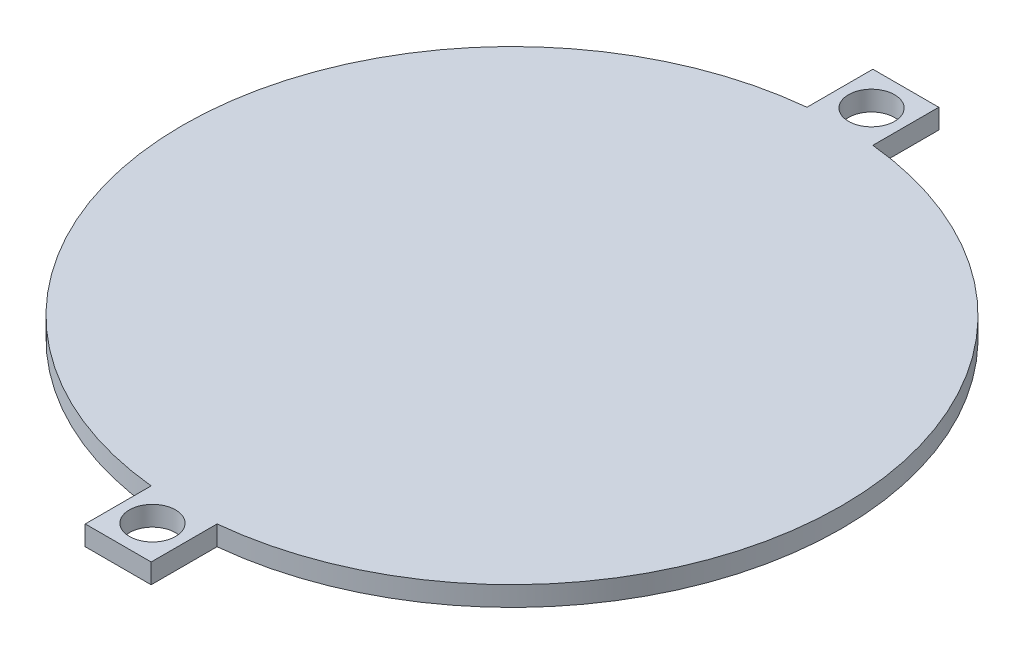
from build123d import *

# Parameters (mm, degrees)
SKETCH2_R               = 50
BOSS_EXTRUDE1_DEPTH     = 12
SKETCH3_R               = 48
CUT_EXTRUDE1_DEPTH      = 10
SKETCH7_W               = 10
SKETCH7_H               = 10
BOSS_EXTRUDE12_DEPTH    = 3
SKETCH8_W               = 10
SKETCH8_H               = 10
BOSS_EXTRUDE13_DEPTH    = 3
SKETCH9_R               = 3.5
CUT_EXTRUDE2_DEPTH      = 10
SKETCH10_R              = 3.5
CUT_EXTRUDE3_DEPTH      = 10
CUT_EXTRUDE4_DEPTH      = 100
CUT_EXTRUDE4_DEPTH_BACK = 100
SKETCH11_W              = 125.880590586
SKETCH11_H              = 15.914036276
BOSS_EXTRUDE15_START    = -3
SKETCH12_R              = 48
BOSS_EXTRUDE15_DEPTH    = 3


with BuildPart() as part:
    # Sketch2 → Boss-Extrude1 (new body)
    with BuildSketch(Plane(origin=(0, 0, 0), x_dir=(1, 0, 0), z_dir=(0, 1, 0))):
        Circle(SKETCH2_R)
    extrude(amount=BOSS_EXTRUDE1_DEPTH)

    # Sketch3 → Cut-Extrude1 (cut)
    with BuildSketch(Plane.XZ):
        Circle(SKETCH3_R)
    extrude(amount=-CUT_EXTRUDE1_DEPTH, mode=Mode.SUBTRACT)

    # Sketch7 → Boss-Extrude12 (add)
    with BuildSketch(Plane(origin=(0, 0, 0), x_dir=(-1, 0, 0), z_dir=(0, -1, 0))):
        with Locations((0, 54.749371855)):
            Rectangle(SKETCH7_W, SKETCH7_H)
    extrude(amount=-BOSS_EXTRUDE12_DEPTH)

    # Sketch8 → Boss-Extrude13 (add)
    with BuildSketch(Plane(origin=(0, 0, 0), x_dir=(-1, 0, 0), z_dir=(0, -1, 0))):
        with Locations((0, -54.749371855)):
            Rectangle(SKETCH8_W, SKETCH8_H)
    extrude(amount=-BOSS_EXTRUDE13_DEPTH)

    # Sketch9 → Cut-Extrude2 (cut)
    with BuildSketch(Plane.XZ):
        with Locations((0, 54.549371855)):
            Circle(SKETCH9_R)
    extrude(amount=-CUT_EXTRUDE2_DEPTH, mode=Mode.SUBTRACT)

    # Sketch10 → Cut-Extrude3 (cut)
    with BuildSketch(Plane.XZ):
        with Locations((0, -54.549371855)):
            Circle(SKETCH10_R)
    extrude(amount=-CUT_EXTRUDE3_DEPTH, mode=Mode.SUBTRACT)

    # Sketch11 → Cut-Extrude4 (cut, two sides: drawn at the far end of the back side and taken through both)
    with BuildSketch(Plane(origin=(5, 0, 0), x_dir=(0, 0, -1), z_dir=(1, 0, 0)).offset(-CUT_EXTRUDE4_DEPTH_BACK)):
        with Locations((3.190923438, 10.957018138)):
            Rectangle(SKETCH11_W, SKETCH11_H)
    extrude(amount=CUT_EXTRUDE4_DEPTH + CUT_EXTRUDE4_DEPTH_BACK, mode=Mode.SUBTRACT)

    # Sketch12 → Boss-Extrude15 (add)
    with BuildSketch(Plane(origin=(0, 3, 0), x_dir=(1, 0, 0), z_dir=(0, 1, 0)).offset(BOSS_EXTRUDE15_START)):
        Circle(SKETCH12_R)
    extrude(amount=BOSS_EXTRUDE15_DEPTH)


solid = part.part
